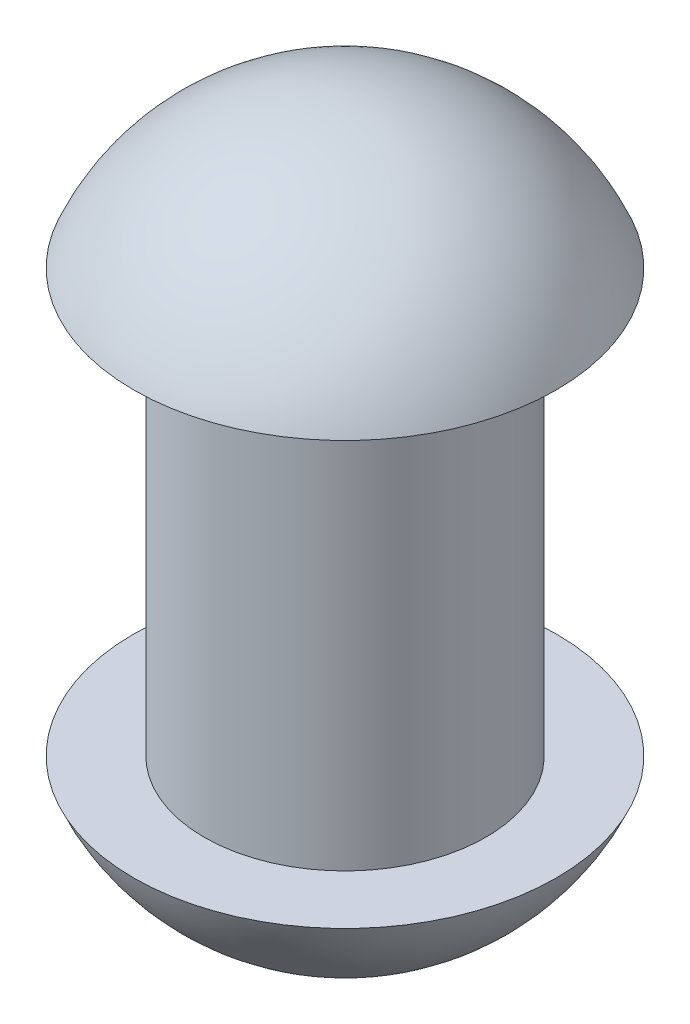
from build123d import *


with BuildPart() as part:
    # 草图1 → 旋转1 (revolve)
    with BuildSketch(Plane.XY, mode=Mode.PRIVATE) as revolve_1_sk:
        with BuildLine():
            Line((0, 0), (0, 5))
            ThreePointArc((0, 5), (0.901387819, 4.727081728), (1.5, 4))
            Line((1.5, 4), (1, 4))
            Line((1, 4), (1, 1))
            Line((1, 1), (1.5, 1))
            ThreePointArc((1.5, 1), (0.901387819, 0.272918272), (0, 0))
        make_face()
    revolve(revolve_1_sk.sketch.rotate(Axis((0, 0, 0), (0, 1, 0)), 90), axis=Axis((0, 0, 0), (0, 1, 0)))


solid = part.part
